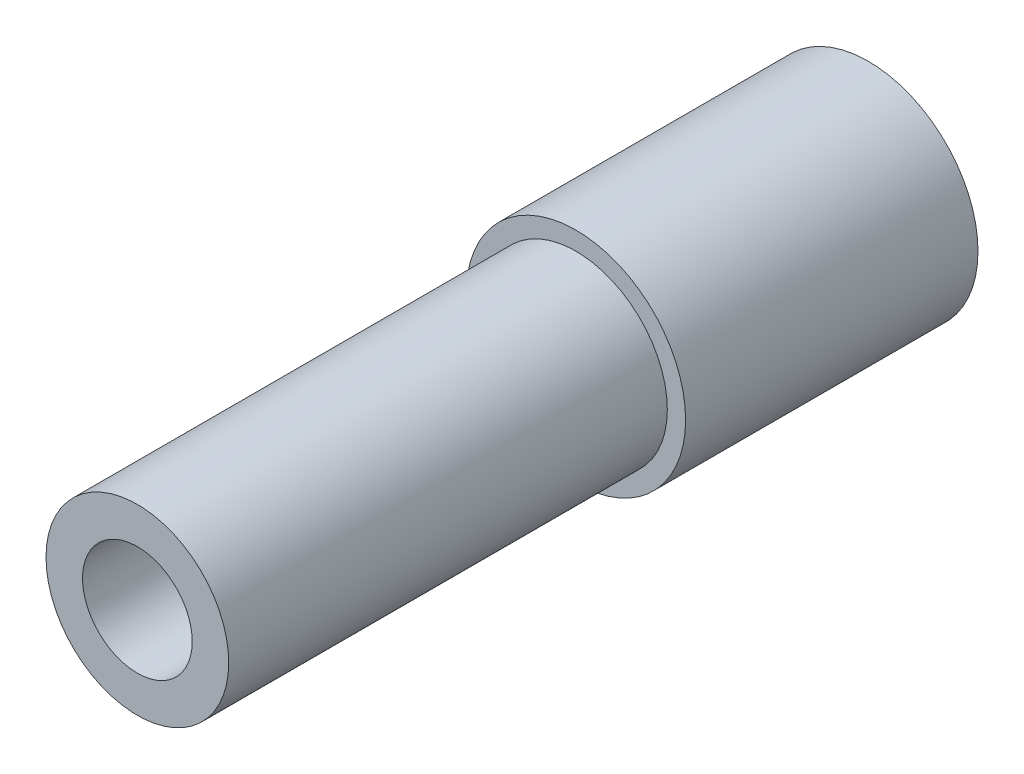
from build123d import *

# Parameters (mm, degrees)
SKETCH1_R           = 15
SKETCH1_R_2         = 11
BOSS_EXTRUDE1_DEPTH = 40
SKETCH2_R           = 12.5
SKETCH2_R_2         = 7.5
BOSS_EXTRUDE2_DEPTH = 60


with BuildPart() as part:
    # Sketch1 → Boss-Extrude1 (new body)
    with BuildSketch(Plane.XY):
        Circle(SKETCH1_R)
        Circle(SKETCH1_R_2, mode=Mode.SUBTRACT)
    extrude(amount=BOSS_EXTRUDE1_DEPTH)

    # Sketch2 → Boss-Extrude2 (add)
    with BuildSketch(Plane.XY.offset(40)):
        Circle(SKETCH2_R)
        Circle(SKETCH2_R_2, mode=Mode.SUBTRACT)
    extrude(amount=BOSS_EXTRUDE2_DEPTH)


solid = part.part
